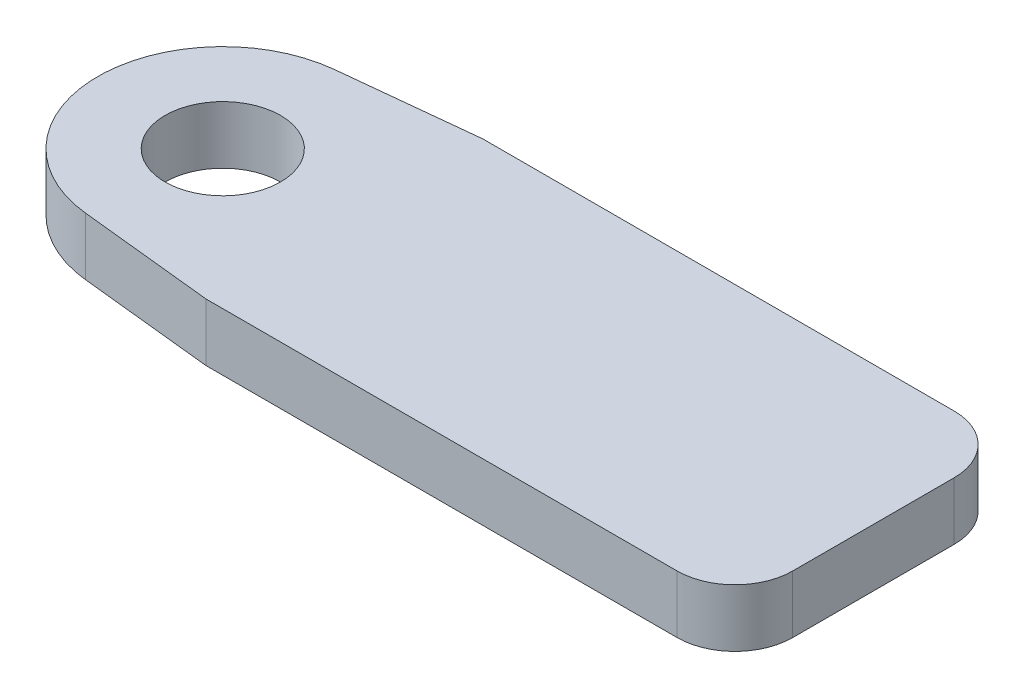
from build123d import *

# Parameters (mm, degrees)
SKETCH1_R           = 0.762
BOSS_EXTRUDE1_DEPTH = 0.381


with BuildPart() as part:
    # Sketch1 → Boss-Extrude1 (new, symmetric)
    with BuildSketch(Plane(origin=(0, 0, 0), x_dir=(1, 0, 0), z_dir=(0, 1, 0))):
        with BuildLine():
            Line((-0.172545192, 1.641958939), (1.605454808, 1.8288))
            Line((1.605454808, 1.8288), (7.828454808, 1.8288))
            ThreePointArc((7.828454808, 1.8288), (8.367270176, 1.605615367), (8.590454808, 1.0668))
            Line((8.590454808, 1.0668), (8.590454808, -1.0668))
            ThreePointArc((8.590454808, -1.0668), (8.367270176, -1.605615367), (7.828454808, -1.8288))
            Line((7.828454808, -1.8288), (1.605454808, -1.8288))
            Line((1.605454808, -1.8288), (-0.172545192, -1.641958939))
            ThreePointArc((-0.172545192, -1.641958939), (-1.651, 0), (-0.172545192, 1.641958939))
        make_face()
        with Locations(Location((0, 0, 0), (0, 0, 90))):
            Circle(SKETCH1_R, mode=Mode.SUBTRACT)
    extrude(amount=BOSS_EXTRUDE1_DEPTH, both=True)


solid = part.part
